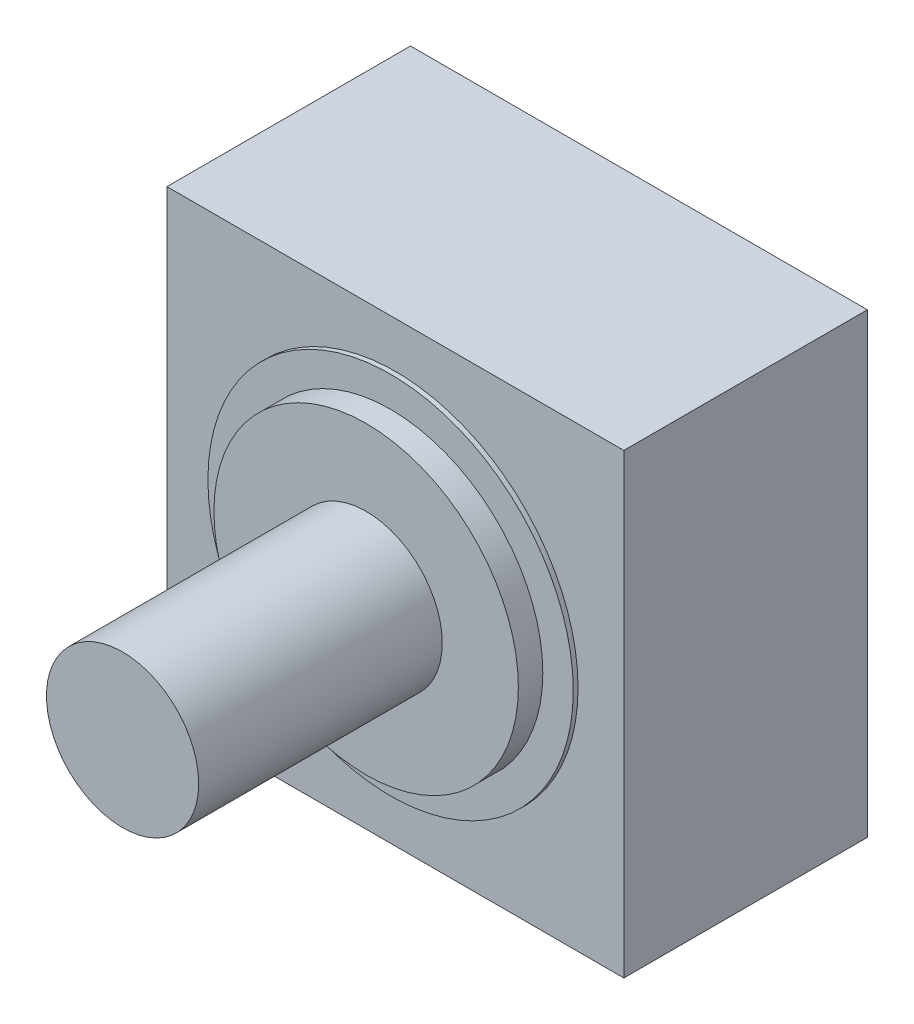
from build123d import *

# Parameters (mm, degrees)
SKETCH1_W           = 9.53
SKETCH1_H           = 9.53
BOSS_EXTRUDE1_DEPTH = 5.08
SKETCH2_R           = 3.81
BOSS_EXTRUDE2_DEPTH = 0.1
SKETCH3_R           = 3.175
BOSS_EXTRUDE3_DEPTH = 0.51
SKETCH4_R           = 1.5875
BOSS_EXTRUDE4_DEPTH = 5.08


with BuildPart() as part:
    # Sketch1 → Boss-Extrude1 (new body)
    with BuildSketch(Plane.XY):
        with Locations((4.765, 4.765)):
            Rectangle(SKETCH1_W, SKETCH1_H)
    extrude(amount=BOSS_EXTRUDE1_DEPTH)

    # Sketch2 → Boss-Extrude2 (add)
    with BuildSketch(Plane.XY.offset(5.08)):
        with Locations(Location((4.765, 4.765, 0), (0, 0, 180))):
            Circle(SKETCH2_R)
    extrude(amount=BOSS_EXTRUDE2_DEPTH)

    # Sketch3 → Boss-Extrude3 (add)
    with BuildSketch(Plane.XY.offset(5.18)):
        with Locations((4.765, 4.765)):
            Circle(SKETCH3_R)
    extrude(amount=BOSS_EXTRUDE3_DEPTH)

    # Sketch4 → Boss-Extrude4 (add)
    with BuildSketch(Plane.XY.offset(5.69)):
        with Locations((4.765, 4.765)):
            Circle(SKETCH4_R)
    extrude(amount=BOSS_EXTRUDE4_DEPTH)


solid = part.part
